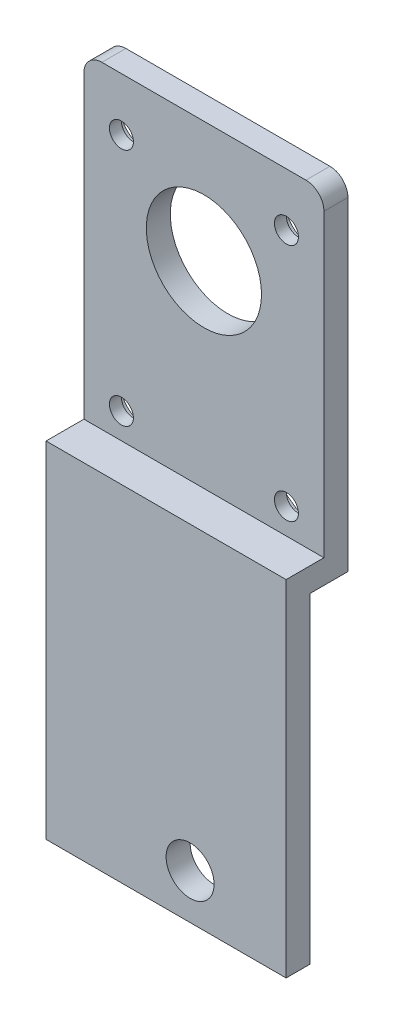
from build123d import *

# Parameters (mm, degrees)
SKETCH1_R           = 4.2
SKETCH1_R_2         = 9.6
BOSS_EXTRUDE1_DEPTH = 2
SKETCH2_W           = 40
SKETCH2_H           = 2
CUT_EXTRUDE1_DEPTH  = 1
SKETCH4_R           = 2
SKETCH4_R_2         = 9.6
BOSS_EXTRUDE3_DEPTH = 2
SKETCH5_W           = 40
SKETCH5_H           = 4
BOSS_EXTRUDE4_DEPTH = 2.3
SKETCH7_W           = 40
SKETCH7_H           = 57.5
SKETCH7_R           = 4
BOSS_EXTRUDE6_DEPTH = 4


with BuildPart() as part:
    # Sketch1 → Boss-Extrude1 (new body)
    with BuildSketch(Plane.XY):
        with BuildLine():
            Line((20, -29), (-20, -29))
            Line((-20, -29), (-20, 26))
            ThreePointArc((-20, 26), (-19.121320344, 28.121320344), (-17, 29))
            Line((-17, 29), (17, 29))
            ThreePointArc((17, 29), (19.121320344, 28.121320344), (20, 26))
            Line((20, 26), (20, -29))
        make_face()
        with Locations((-13.75, 20.15)):
            Circle(SKETCH1_R, mode=Mode.SUBTRACT)
        with Locations((13.75, 20.15)):
            Circle(SKETCH1_R, mode=Mode.SUBTRACT)
        with Locations((-13.75, -19.7)):
            Circle(SKETCH1_R, mode=Mode.SUBTRACT)
        with Locations((0, 8.8)):
            Circle(SKETCH1_R_2, mode=Mode.SUBTRACT)
        with Locations((-5.725, -6.1)):
            Circle(SKETCH1_R, mode=Mode.SUBTRACT)
        with Locations((5.725, -6.1)):
            Circle(SKETCH1_R, mode=Mode.SUBTRACT)
        with BuildLine():
            Line((11.314, -23.121389192), (7.240917629, -20.221389192))
            ThreePointArc((7.240917629, -20.221389192), (6.255528438, -14.364), (12.112917629, -13.378610808))
            Line((12.112917629, -13.378610808), (16.186, -16.278610808))
            ThreePointArc((16.186, -16.278610808), (17.171389192, -22.136), (11.314, -23.121389192))
        make_face(mode=Mode.SUBTRACT)
    extrude(amount=BOSS_EXTRUDE1_DEPTH)

    # Sketch2 → Cut-Extrude1 (cut)
    with BuildSketch(Plane.XZ.offset(29)):
        with Locations((0, 1)):
            Rectangle(SKETCH2_W, SKETCH2_H)
    extrude(amount=-CUT_EXTRUDE1_DEPTH, mode=Mode.SUBTRACT)

    # Sketch4 → Boss-Extrude3 (add)
    with BuildSketch(Plane.XY.offset(2)):
        with BuildLine():
            Line((-17, 29), (17, 29))
            ThreePointArc((17, 29), (19.121320344, 28.121320344), (20, 26))
            Line((20, 26), (20, -28))
            Line((20, -28), (-20, -28))
            Line((-20, -28), (-20, 26))
            ThreePointArc((-20, 26), (-19.121320344, 28.121320344), (-17, 29))
        make_face()
        with Locations((-13.75, -19.7)):
            Circle(SKETCH4_R, mode=Mode.SUBTRACT)
        with Locations((-13.75, 20.15)):
            Circle(SKETCH4_R, mode=Mode.SUBTRACT)
        with Locations((13.75, 20.15)):
            Circle(SKETCH4_R, mode=Mode.SUBTRACT)
        with Locations((13.75, -19.7)):
            Circle(SKETCH4_R, mode=Mode.SUBTRACT)
        with Locations((0, 8.8)):
            Circle(SKETCH4_R_2, mode=Mode.SUBTRACT)
    extrude(amount=BOSS_EXTRUDE3_DEPTH)

    # Sketch5 → Boss-Extrude4 (add)
    with BuildSketch(Plane.XY.offset(4)):
        with Locations((0, -26)):
            Rectangle(SKETCH5_W, SKETCH5_H)
    extrude(amount=BOSS_EXTRUDE4_DEPTH)

    # Sketch7 → Boss-Extrude6 (add)
    with BuildSketch(Plane.XY.offset(6.3)):
        with Locations((0, -52.75)):
            Rectangle(SKETCH7_W, SKETCH7_H)
        with Locations((4, -74)):
            Circle(SKETCH7_R, mode=Mode.SUBTRACT)
    extrude(amount=BOSS_EXTRUDE6_DEPTH)


solid = part.part
